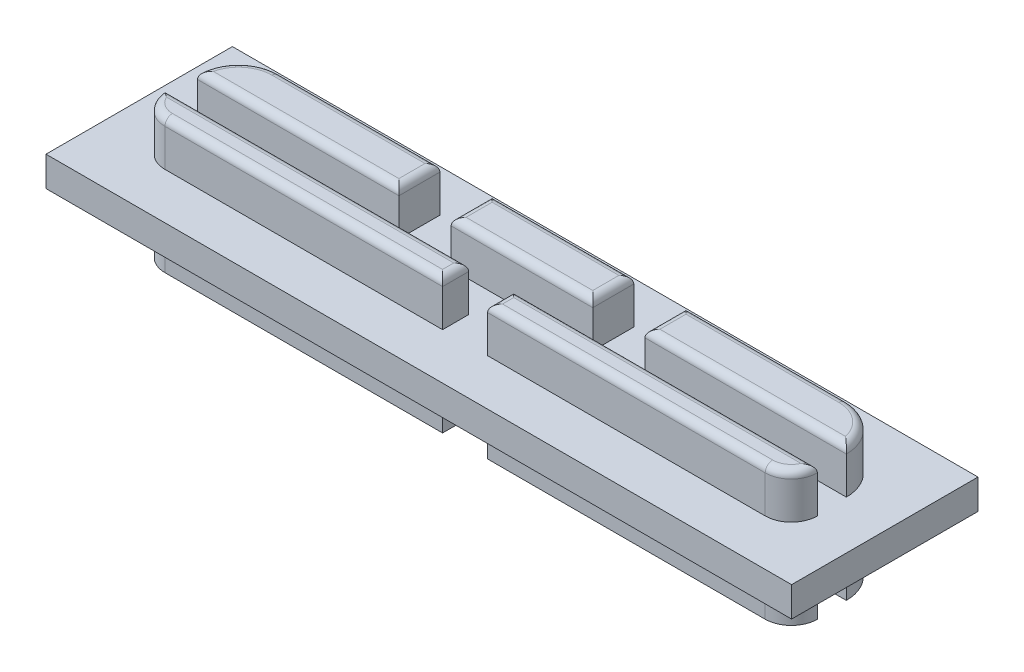
from build123d import *

# Parameters (mm, degrees)
BOSS_EXTRUDE1_DEPTH        = 2.032
BOSS_EXTRUDE1_DEPTH_BACK   = 2.54
BOSS_EXTRUDE1_2_DEPTH      = 2.032
BOSS_EXTRUDE1_2_DEPTH_BACK = 2.54
BOSS_EXTRUDE1_3_DEPTH      = 2.032
BOSS_EXTRUDE1_3_DEPTH_BACK = 2.54
SKETCH1_W                  = 4.826
SKETCH1_H                  = 1.397
BOSS_EXTRUDE1_4_DEPTH      = 2.032
BOSS_EXTRUDE1_4_DEPTH_BACK = 2.54
BOSS_EXTRUDE1_5_DEPTH      = 2.032
BOSS_EXTRUDE1_5_DEPTH_BACK = 2.54
BOSS_EXTRUDE2_DEPTH        = 0.508
BOSS_EXTRUDE2_DEPTH_BACK   = 0.508
SKETCH1_3_W                = 25.4
SKETCH1_3_H                = 6.35
SKETCH1_3_W_2              = 4.826
SKETCH1_3_H_2              = 1.397
FILLET1_R                  = 0.254


with BuildPart() as part:
    # Sketch1 → Boss-Extrude1 (new, two sides: drawn at the far end of the back side and taken through both)
    with BuildSketch(Plane(origin=(0, 3.048, 0), x_dir=(1, 0, 0), z_dir=(0, 1, 0)).offset(-BOSS_EXTRUDE1_DEPTH_BACK)):
        with BuildLine():
            Line((-4.181695904, 27.009366894), (-9.644992793, 27.009366894))
            ThreePointArc((-9.644992793, 27.009366894), (-10.632820966, 26.600195068), (-11.041992793, 25.612366894))
            Line((-11.041992793, 25.612366894), (-4.181695904, 25.612366894))
            Line((-4.181695904, 25.612366894), (-4.181695904, 27.009366894))
        make_face()
    extrude(amount=BOSS_EXTRUDE1_DEPTH + BOSS_EXTRUDE1_DEPTH_BACK)



with BuildPart() as body_2:
    # Sketch1 → Boss-Extrude1 2 (new, two sides: drawn at the far end of the back side and taken through both)
    with BuildSketch(Plane(origin=(0, 3.048, 0), x_dir=(1, 0, 0), z_dir=(0, 1, 0)).offset(-BOSS_EXTRUDE1_2_DEPTH_BACK)):
        with BuildLine():
            Line((0.776095842, 24.564616894), (0.776095842, 23.675616894))
            Line((0.776095842, 23.675616894), (10.23259664, 23.675616894))
            ThreePointArc((10.23259664, 23.675616894), (10.861214569, 23.935998966), (11.12159664, 24.564616894))
            Line((11.12159664, 24.564616894), (0.776095842, 24.564616894))
        make_face()
    extrude(amount=BOSS_EXTRUDE1_2_DEPTH + BOSS_EXTRUDE1_2_DEPTH_BACK)


with BuildPart() as body_3:
    # Sketch1 → Boss-Extrude1 3 (new, two sides: drawn at the far end of the back side and taken through both)
    with BuildSketch(Plane(origin=(0, 3.048, 0), x_dir=(1, 0, 0), z_dir=(0, 1, 0)).offset(-BOSS_EXTRUDE1_3_DEPTH_BACK)):
        with Locations((0.009304096, 26.310866894)):
            Rectangle(SKETCH1_W, SKETCH1_H)
    extrude(amount=BOSS_EXTRUDE1_3_DEPTH + BOSS_EXTRUDE1_3_DEPTH_BACK)


with BuildPart() as body_4:
    # Sketch1 → Boss-Extrude1 4 (new, two sides: drawn at the far end of the back side and taken through both)
    with BuildSketch(Plane(origin=(0, 3.048, 0), x_dir=(1, 0, 0), z_dir=(0, 1, 0)).offset(-BOSS_EXTRUDE1_4_DEPTH_BACK)):
        with BuildLine():
            Line((9.663600985, 27.009366894), (4.200304096, 27.009366894))
            Line((4.200304096, 27.009366894), (4.200304096, 25.612366894))
            Line((4.200304096, 25.612366894), (11.060600985, 25.612366894))
            ThreePointArc((11.060600985, 25.612366894), (10.651429158, 26.600195068), (9.663600985, 27.009366894))
        make_face()
    extrude(amount=BOSS_EXTRUDE1_4_DEPTH + BOSS_EXTRUDE1_4_DEPTH_BACK)


with BuildPart() as body_5:
    # Sketch1 → Boss-Extrude1 5 (new, two sides: drawn at the far end of the back side and taken through both)
    with BuildSketch(Plane(origin=(0, 3.048, 0), x_dir=(1, 0, 0), z_dir=(0, 1, 0)).offset(-BOSS_EXTRUDE1_5_DEPTH_BACK)):
        with BuildLine():
            Line((-0.75748765, 23.675616894), (-0.75748765, 24.564616894))
            Line((-0.75748765, 24.564616894), (-11.102988449, 24.564616894))
            ThreePointArc((-11.102988449, 24.564616894), (-10.842606377, 23.935998966), (-10.213988449, 23.675616894))
            Line((-10.213988449, 23.675616894), (-0.75748765, 23.675616894))
        make_face()
    extrude(amount=BOSS_EXTRUDE1_5_DEPTH + BOSS_EXTRUDE1_5_DEPTH_BACK)


with BuildPart() as part_1:
    add(part.part)

    add(body_2.part)  # Boss-Extrude2 merges body 2

    add(body_3.part)  # Boss-Extrude2 merges body 3

    add(body_4.part)  # Boss-Extrude2 merges body 4

    add(body_5.part)  # Boss-Extrude2 merges body 5
    # Sketch1<3> → Boss-Extrude2 (add, two sides: drawn at the far end of the back side and taken through both)
    with BuildSketch(Plane(origin=(0, 3.048, 0), x_dir=(1, 0, 0), z_dir=(0, 1, 0)).offset(-BOSS_EXTRUDE2_DEPTH_BACK)):
        with Locations((0.009304096, 25.273558827)):
            Rectangle(SKETCH1_3_W, SKETCH1_3_H)
        with BuildLine():
            Line((-11.102988449, 24.564616894), (-0.75748765, 24.564616894))
            Line((-0.75748765, 24.564616894), (-0.75748765, 23.675616894))
            Line((-0.75748765, 23.675616894), (-10.213988449, 23.675616894))
            ThreePointArc((-10.213988449, 23.675616894), (-10.842606377, 23.935998966), (-11.102988449, 24.564616894))
        make_face(mode=Mode.SUBTRACT)
        with BuildLine():
            Line((10.23259664, 23.675616894), (0.776095842, 23.675616894))
            Line((0.776095842, 23.675616894), (0.776095842, 24.564616894))
            Line((0.776095842, 24.564616894), (11.12159664, 24.564616894))
            ThreePointArc((11.12159664, 24.564616894), (10.861214569, 23.935998966), (10.23259664, 23.675616894))
        make_face(mode=Mode.SUBTRACT)
        with BuildLine():
            ThreePointArc((-11.041992793, 25.612366894), (-10.632820966, 26.600195068), (-9.644992793, 27.009366894))
            Line((-9.644992793, 27.009366894), (-4.181695904, 27.009366894))
            Line((-4.181695904, 27.009366894), (-4.181695904, 25.612366894))
            Line((-4.181695904, 25.612366894), (-11.041992793, 25.612366894))
        make_face(mode=Mode.SUBTRACT)
        with Locations((0.009304096, 26.310866894)):
            Rectangle(SKETCH1_3_W_2, SKETCH1_3_H_2, mode=Mode.SUBTRACT)
        with BuildLine():
            Line((4.200304096, 25.612366894), (4.200304096, 27.009366894))
            Line((4.200304096, 27.009366894), (9.663600985, 27.009366894))
            ThreePointArc((9.663600985, 27.009366894), (10.651429158, 26.600195068), (11.060600985, 25.612366894))
            Line((11.060600985, 25.612366894), (4.200304096, 25.612366894))
        make_face(mode=Mode.SUBTRACT)
    extrude(amount=BOSS_EXTRUDE2_DEPTH + BOSS_EXTRUDE2_DEPTH_BACK)

    # Fillet1
    fillet1_edges = [part_1.edges().sort_by_distance(p)[0] for p in [
        (0.009304096, 5.08, -25.612366894),
        (-2.403695904, 5.08, -26.310866894),
        (0.009304096, 5.08, -27.009366894),
        (2.422304096, 5.08, -26.310866894),
        (-7.611844348, 5.08, -25.612366894),
        (-10.632820966, 5.08, -26.600195068),
        (-6.913344348, 5.08, -27.009366894),
        (-4.181695904, 5.08, -26.310866894),
        (-5.485738049, 5.08, -23.675616894),
        (-10.842606377, 5.08, -23.935998966),
        (-5.930238049, 5.08, -24.564616894),
        (-0.75748765, 5.08, -24.120116894),
        (5.948846241, 5.08, -24.564616894),
        (10.861214569, 5.08, -23.935998966),
        (5.504346241, 5.08, -23.675616894),
        (0.776095842, 5.08, -24.120116894),
        (4.200304096, 5.08, -26.310866894),
        (6.93195254, 5.08, -27.009366894),
        (10.651429158, 5.08, -26.600195068),
        (7.63045254, 5.08, -25.612366894),
    ]]
    fillet(fillet1_edges, radius=FILLET1_R)


solid = part_1.part
